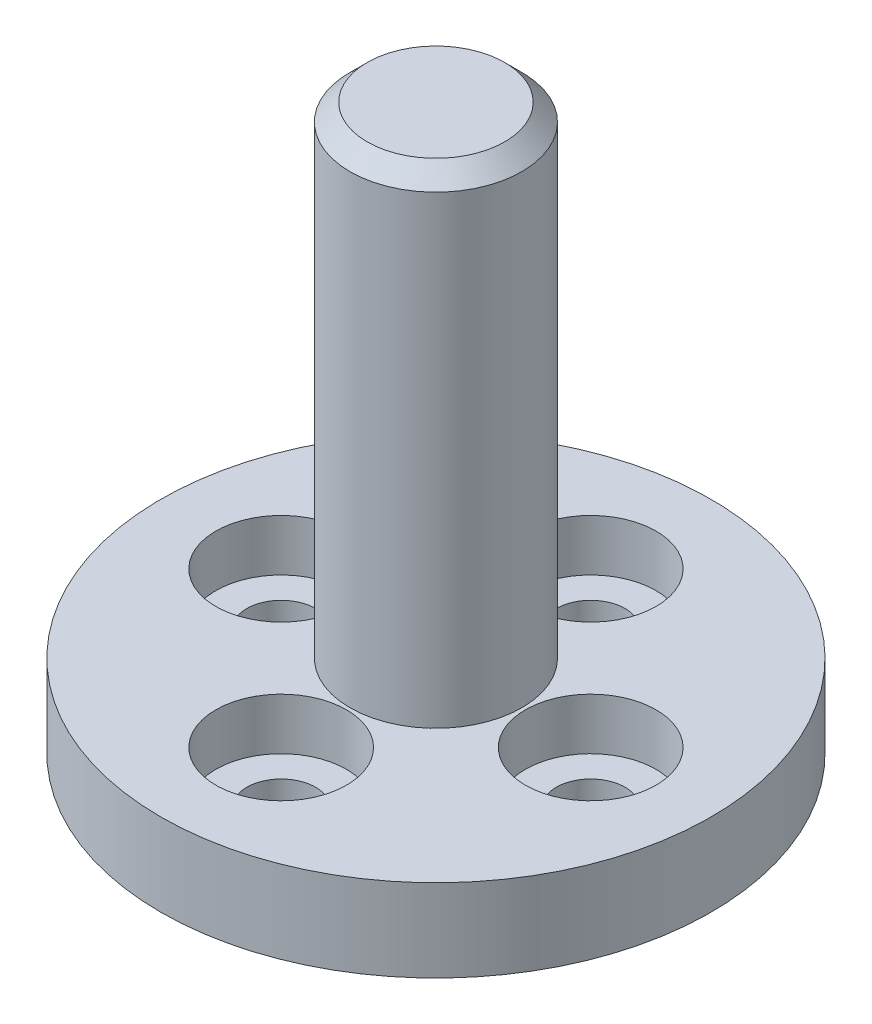
from build123d import *

# Parameters (mm, degrees)
ESQUISSE1_R                  = 8
BOSS_EXTRU_1_DEPTH           = 2.4
ESQUISSE2_R                  = 2.5
BOSS_EXTRU_2_DEPTH           = 14
ESQUISSE3_R                  = 1
ENL_V_MAT_EXTRU_1_DEPTH      = 7
ESQUISSE4_R                  = 1.9
ENL_V_MAT_EXTRU_2_DEPTH      = 1.5
R_P_TITION_CIRCULAIRE2_COUNT = 4
CHANFREIN1_SIZE              = 0.5
ESQUISSE5_R                  = 1
ENL_V_MAT_EXTRU_3_DEPTH      = 1.6


with BuildPart() as part:
    # Esquisse1 → Boss.-Extru.1 (new body)
    with BuildSketch(Plane(origin=(0, 0, 0), x_dir=(1, 0, 0), z_dir=(0, 1, 0))):
        with Locations(Location((0, 0, 0), (0, 0, 270))):
            Circle(ESQUISSE1_R)
    extrude(amount=BOSS_EXTRU_1_DEPTH)

    # Esquisse2 → Boss.-Extru.2 (add)
    with BuildSketch(Plane(origin=(0, 2.4, 0), x_dir=(1, 0, 0), z_dir=(0, 1, 0))):
        with Locations(Location((0, 0, 0), (0, 0, 270))):
            Circle(ESQUISSE2_R)
    extrude(amount=BOSS_EXTRU_2_DEPTH)

    # Esquisse3 → Enlèv. mat.-Extru.1 (cut)
    with BuildSketch(Plane(origin=(0, 2.4, 0), x_dir=(1, 0, 0), z_dir=(0, 1, 0))):
        with Locations(Location((4.5, 0, 0), (0, 0, 270))):
            Circle(ESQUISSE3_R)
    enl_v_mat_extru_1 = extrude(amount=-ENL_V_MAT_EXTRU_1_DEPTH, mode=Mode.SUBTRACT)

    # Esquisse4 → Enlèv. mat.-Extru.2 (cut)
    with BuildSketch(Plane(origin=(0, 2.4, 0), x_dir=(1, 0, 0), z_dir=(0, 1, 0))):
        with Locations(Location((4.5, 0, 0), (0, 0, 270))):
            Circle(ESQUISSE4_R)
    enl_v_mat_extru_2 = extrude(amount=-ENL_V_MAT_EXTRU_2_DEPTH, mode=Mode.SUBTRACT)

    # Répétition circulaire2: Enlèv. mat.-Extru.1, Enlèv. mat.-Extru.2 ×4 about axis
    r_p_tition_circulaire2_axis = Axis((0, 0, 0), (0, 1, 0))
    add([enl_v_mat_extru_1.rotate(r_p_tition_circulaire2_axis, i * 360 / R_P_TITION_CIRCULAIRE2_COUNT) for i in range(1, R_P_TITION_CIRCULAIRE2_COUNT)], mode=Mode.SUBTRACT)
    add([enl_v_mat_extru_2.rotate(r_p_tition_circulaire2_axis, i * 360 / R_P_TITION_CIRCULAIRE2_COUNT) for i in range(1, R_P_TITION_CIRCULAIRE2_COUNT)], mode=Mode.SUBTRACT)

    # Chanfrein1
    chanfrein1_edges = [part.edges().sort_by_distance(p)[0] for p in [
        (0, 16.4, -2.5),
    ]]
    chamfer(chanfrein1_edges, length=CHANFREIN1_SIZE)

    # Esquisse5 → Enlèv. mat.-Extru.3 (cut)
    with BuildSketch(Plane.XZ):
        with Locations(Location((0, 0, 0), (0, 0, 270))):
            Circle(ESQUISSE5_R)
    extrude(amount=-ENL_V_MAT_EXTRU_3_DEPTH, mode=Mode.SUBTRACT)


solid = part.part
